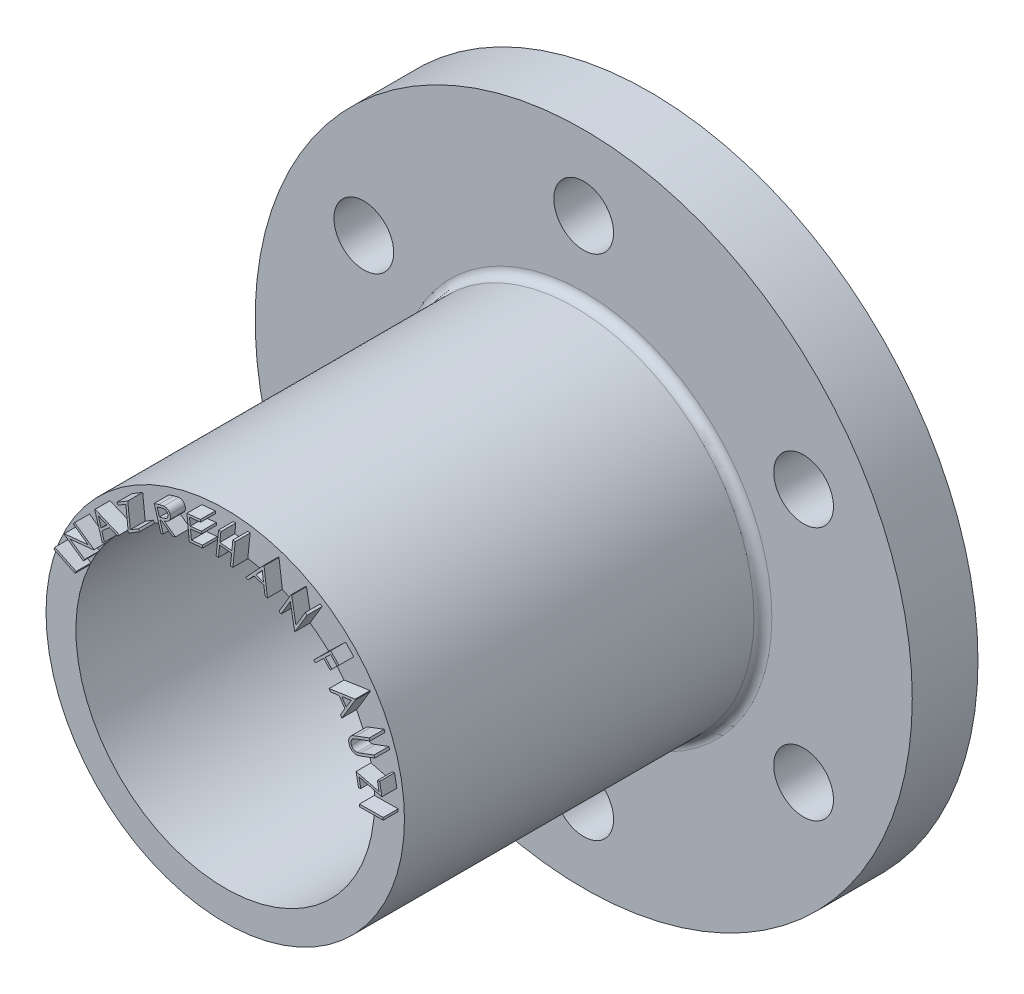
from build123d import *

# Parameters (mm, degrees)
SKETCH1_R           = 110
BOSS_EXTRUDE1_DEPTH = 22
SKETCH2_R           = 60
BOSS_EXTRUDE2_DEPTH = 120
SKETCH3_R           = 50
CUT_EXTRUDE1_DEPTH  = 211.627633515
SKETCH4_R           = 10
CUT_EXTRUDE2_DEPTH  = 197.468827044
FILLET1_R           = 3
BOSS_EXTRUDE3_DEPTH = 5


with BuildPart() as part:
    # Sketch1 → Boss-Extrude1 (new body)
    with BuildSketch(Plane.XY):
        Circle(SKETCH1_R)
    extrude(amount=BOSS_EXTRUDE1_DEPTH)

    # Sketch2 → Boss-Extrude2 (add)
    with BuildSketch(Plane.XY.offset(22)):
        Circle(SKETCH2_R)
    extrude(amount=BOSS_EXTRUDE2_DEPTH)

    # Sketch3 → Cut-Extrude1 (cut, through all)
    with BuildSketch(Plane.XY.offset(142)):
        Circle(SKETCH3_R)
    extrude(amount=-CUT_EXTRUDE1_DEPTH, mode=Mode.SUBTRACT)

    # Sketch4 → Cut-Extrude2 (cut, through all)
    with BuildSketch(Plane.XY.offset(22)):
        with Locations((0, 85)):
            Circle(SKETCH4_R)
        with Locations((73.612159322, 42.5)):
            Circle(SKETCH4_R)
        with Locations((73.612159322, -42.5)):
            Circle(SKETCH4_R)
        with Locations((0, -85)):
            Circle(SKETCH4_R)
        with Locations((-73.612159322, -42.5)):
            Circle(SKETCH4_R)
        with Locations((-73.612159322, 42.5)):
            Circle(SKETCH4_R)
    extrude(amount=-CUT_EXTRUDE2_DEPTH, mode=Mode.SUBTRACT)

    # Fillet1
    fillet1_edges = [part.edges().sort_by_distance(p)[0] for p in [
        (-60, 0, 22),
    ]]
    fillet(fillet1_edges, radius=FILLET1_R)

    # Sketch5 → Boss-Extrude3 (add)
    # profile 1 of 14: a face of its own
    with BuildSketch(Plane.XY.offset(142)):
        Polygon((57.889690715, 2.009597673), (57.900908664, 1.214725878), (49.944177894, 1.118572032), (49.932959946, 1.913443826), align=None)
    # profile 2 of 14: a face of its own
    with BuildSketch(Plane.XY.offset(142)):
        Polygon((55.930337648, 11.745643065), (56.68514534, 11.886668707), (57.449568417, 7.766476399), (49.794119699, 9.724809732), (50.369440212, 6.623848194), (49.609824828, 6.482822553), (48.81014534, 10.787309732), (56.475209443, 8.80974563), align=None)
    # profile 3 of 14: a face of its own
    with BuildSketch(Plane.XY.offset(142)):
        with BuildLine():
            Line((53.221706155, 22.727270686), (53.500552309, 21.983680942))
            Line((53.500552309, 21.983680942), (49.008565129, 20.304193763))
            add(Edge.make_bspline(
                [(49.008565129, 20.304193763), (48.944985787, 20.280185336), (48.824142847, 20.234553395), (48.652984523, 20.169396557), (48.501622149, 20.109215852), (48.368531012, 20.05729421), (48.25504079, 20.008983815), (48.160428472, 19.967445769), (48.08480114, 19.932724798), (48.041614765, 19.910104072), (48.022988206, 19.900347609)],
                knots=[0, 0, 0, 0, 1.530622665, 2.909198734, 4.12455856, 5.199154976, 6.12647182, 6.902162162, 7.526495533, 8, 8, 8, 8], degree=3))
            add(Edge.make_bspline(
                [(48.022988206, 19.900347609), (47.956394121, 19.863325512), (47.827654126, 19.791754223), (47.654297555, 19.663736071), (47.505952995, 19.523701881), (47.379088885, 19.371198347), (47.278436184, 19.199557618), (47.201075725, 19.006702797), (47.145539368, 18.791881044), (47.115199109, 18.559448568), (47.107082419, 18.321076482), (47.122795769, 18.085798669), (47.162969292, 17.858184847), (47.211856733, 17.713948028), (47.236129232, 17.642334788)],
                knots=[0, 0, 0, 0, 1.041571954, 2.013571717, 2.938929409, 3.826941683, 4.718075908, 5.649043884, 6.661177538, 7.745360051, 8.849482269, 9.918959202, 10.96676817, 12, 12, 12, 12], degree=3))
            add(Edge.make_bspline(
                [(47.236129232, 17.642334788), (47.260880986, 17.581821124), (47.309942487, 17.461874427), (47.408662997, 17.294123605), (47.522275335, 17.135810211), (47.654930657, 16.990990527), (47.80173179, 16.861665591), (47.959597827, 16.750186873), (48.127356422, 16.658324187), (48.304518526, 16.585523812), (48.491806843, 16.533988178), (48.688092788, 16.504591701), (48.893211015, 16.492057162), (49.032091207, 16.501359499), (49.103116411, 16.50611684)],
                knots=[0, 0, 0, 0, 0.99761356, 1.977412061, 2.964962012, 3.970057155, 4.970337245, 5.948401076, 6.916198033, 7.88605706, 8.868028066, 9.875604724, 10.9135556, 12, 12, 12, 12], degree=3))
            add(Edge.make_bspline(
                [(49.103116411, 16.50611684), (49.132009992, 16.510103817), (49.195988717, 16.518932135), (49.300281721, 16.540428027), (49.422860665, 16.570938264), (49.5620628, 16.613777984), (49.720940503, 16.66107171), (49.895936782, 16.7207124), (50.088829398, 16.790459496), (50.223318209, 16.839422977), (50.29382154, 16.865091199)],
                knots=[0, 0, 0, 0, 0.56172803, 1.243827937, 2.049941123, 2.994162894, 4.048781236, 5.243004811, 6.554695039, 8, 8, 8, 8], degree=3))
            Line((50.29382154, 16.865091199), (54.785808719, 18.544578378))
            Line((54.785808719, 18.544578378), (55.064654873, 17.800988635))
            Line((55.064654873, 17.800988635), (50.572667693, 16.121501455))
            add(Edge.make_bspline(
                [(50.572667693, 16.121501455), (50.491682604, 16.091510514), (50.333222671, 16.032828569), (50.097981784, 15.957281844), (49.873082007, 15.888348468), (49.657251846, 15.833279452), (49.451812016, 15.785791054), (49.255593787, 15.750013194), (49.068807098, 15.726619691), (48.890310159, 15.710708197), (48.71663382, 15.708622349), (48.544770688, 15.722369482), (48.372853561, 15.746744018), (48.202418324, 15.789935025), (48.032244946, 15.844566345), (47.86120502, 15.911488372), (47.692384826, 15.995844887), (47.523975128, 16.090495192), (47.363435572, 16.201399751), (47.209678716, 16.322245268), (47.070355025, 16.459885044), (46.941573084, 16.609315335), (46.824380066, 16.77190514), (46.718115035, 16.947573776), (46.623654678, 17.136418227), (46.570661006, 17.269064355), (46.54382154, 17.336245045)],
                knots=[0, 0, 0, 0, 1.297889816, 2.539523431, 3.713116984, 4.832906077, 5.886700863, 6.882072144, 7.829186522, 8.715358273, 9.57452841, 10.436058961, 11.304743594, 12.1810758, 13.074889758, 13.990368168, 14.938367032, 15.909378519, 16.891513671, 17.868350352, 18.844956013, 19.829942452, 20.830546276, 21.853672757, 22.912959273, 24, 24, 24, 24], degree=3))
            add(Edge.make_bspline(
                [(46.54382154, 17.336245045), (46.517091922, 17.410684144), (46.464732859, 17.556498481), (46.405856218, 17.777959909), (46.361475636, 17.995652925), (46.336926851, 18.211205156), (46.324164805, 18.423200881), (46.331430414, 18.632196333), (46.353032564, 18.838186363), (46.393929121, 19.039371155), (46.447546841, 19.234702436), (46.517025877, 19.420906827), (46.59838399, 19.597533015), (46.693543993, 19.763963672), (46.802901778, 19.920159558), (46.927063942, 20.065758529), (47.062698845, 20.203174276), (47.163199401, 20.284278403), (47.213693334, 20.325027096)],
                knots=[0, 0, 0, 0, 1.153688589, 2.259892144, 3.340728777, 4.392704464, 5.423115781, 6.436970484, 7.440705661, 8.442046695, 9.429301063, 10.393670745, 11.338819835, 12.264119443, 13.18754554, 14.116777034, 15.053822806, 16, 16, 16, 16], degree=3))
            add(Edge.make_bspline(
                [(47.213693334, 20.325027096), (47.24908495, 20.351263201), (47.325717569, 20.408071612), (47.458498455, 20.486273909), (47.612240489, 20.572057301), (47.791051676, 20.659246268), (47.992326188, 20.752042072), (48.217289005, 20.848270892), (48.46569859, 20.94692846), (48.639361975, 21.013267386), (48.729718976, 21.047783506)],
                knots=[0, 0, 0, 0, 0.627342832, 1.358370441, 2.193044037, 3.135957267, 4.191745134, 5.351104634, 6.621780628, 8, 8, 8, 8], degree=3))
            Line((48.729718976, 21.047783506), (53.221706155, 22.727270686))
        make_face()
    # profile 4 of 14: a face of its own
    with BuildSketch(Plane.XY.offset(142)):
        Polygon((48.60264696, 31.451323587), (44.049762345, 23.904849228), (43.572198242, 24.61638769), (45.052967473, 27.122797946), (43.133095678, 29.980169741), (40.25489055, 29.552285126), (39.759698242, 30.291067177), (48.493672601, 31.613182562), align=None)
        Polygon((47.142711062, 30.587541536), (43.974441832, 30.113182562), (45.496877729, 27.847156921), align=None, mode=Mode.SUBTRACT)
    # profile 5 of 14: a face of its own
    with BuildSketch(Plane.XY.offset(142)):
        Polygon((40.287668103, 41.540201608), (43.05209118, 38.698855454), (42.492796308, 38.153983659), (40.276450154, 40.432829813), (38.502411692, 38.708470839), (40.718757846, 36.429624685), (40.159462975, 35.88475289), (37.943116821, 38.163599044), (35.162668103, 35.460073403), (34.61459118, 36.022573403), align=None)
    # profile 6 of 14: a face of its own
    with BuildSketch(Plane.XY.offset(142)):
        Polygon((22.991479633, 44.324430711), (27.076415531, 51.175392249), (27.225453992, 51.087251224), (28.653338608, 43.127315326), (31.779941172, 48.37090507), (32.456223223, 47.967058916), (28.371287325, 41.116097377), (28.217441172, 41.207443531), (26.787953992, 49.082443531), (23.699812966, 43.902956352), align=None)
    # profile 7 of 14: a face of its own
    with BuildSketch(Plane.XY.offset(142)):
        Polygon((17.995237439, 54.955604754), (19.125045131, 46.244066293), (18.309340003, 46.503681677), (17.910301542, 49.378681677), (14.639468208, 50.415540652), (12.661904106, 48.295348344), (11.81575026, 48.564579113), (17.809340003, 55.014899626), align=None)
        Polygon((17.391070772, 53.377079113), (15.211583593, 51.040540652), (17.806134875, 50.216822703), align=None, mode=Mode.SUBTRACT)
    # profile 8 of 14: a face of its own
    with BuildSketch(Plane.XY.offset(142)):
        Polygon((2.748785358, 57.776850213), (3.542054589, 57.696722008), (3.207118692, 54.390632264), (7.215131512, 53.983580982), (7.55006741, 57.289670725), (8.34333664, 57.20954252), (7.543657153, 49.3265297), (6.750387922, 49.406657905), (7.136605871, 53.211145084), (3.128593051, 53.618196366), (2.742375102, 49.813709187), (1.949105871, 49.893837392), align=None)
    # profile 9 of 14: a face of its own
    with BuildSketch(Plane.XY.offset(142)):
        Polygon((-7.825227036, 57.33819266), (-3.307598831, 57.796525993), (-3.22907319, 57.019282403), (-6.95984242, 56.641077275), (-6.70984242, 54.176333685), (-3.011124472, 54.551333685), (-2.932598831, 53.778897788), (-6.631316779, 53.403897788), (-6.317214215, 50.312551634), (-2.618496267, 50.687551634), (-2.539970626, 49.910308044), (-7.025547549, 49.455179839), align=None)
    # profile 10 of 14: a face of its own
    with BuildSketch(Plane.XY.offset(142)):
        with BuildLine():
            Line((-18.789459191, 54.715105483), (-17.278241242, 55.165425996))
            add(Edge.make_bspline(
                [(-17.278241242, 55.165425996), (-17.176868124, 55.195766639), (-16.983119681, 55.253754914), (-16.70328044, 55.330235051), (-16.448484427, 55.397621441), (-16.21867164, 55.456148619), (-16.012843559, 55.501389992), (-15.831539876, 55.534690822), (-15.675165896, 55.560432476), (-15.578516638, 55.568717187), (-15.534651498, 55.572477278)],
                knots=[0, 0, 0, 0, 1.416180788, 2.706662563, 3.882425669, 4.943640466, 5.880417398, 6.702144752, 7.410956657, 8, 8, 8, 8], degree=3))
            add(Edge.make_bspline(
                [(-15.534651498, 55.572477278), (-15.475365788, 55.574967824), (-15.358355977, 55.579883313), (-15.184100881, 55.571757352), (-15.014761792, 55.549371436), (-14.849850835, 55.513509257), (-14.689513644, 55.466428041), (-14.534700338, 55.402459822), (-14.383981343, 55.327329522), (-14.238171307, 55.239667307), (-14.100714927, 55.138431259), (-13.971854984, 55.027020815), (-13.856374242, 54.901738392), (-13.749104559, 54.767584613), (-13.657574112, 54.61876411), (-13.572820331, 54.46112021), (-13.501037017, 54.291379313), (-13.462719649, 54.172681924), (-13.443305345, 54.112541381)],
                knots=[0, 0, 0, 0, 1.028064753, 2.029049847, 3.018969712, 3.98504948, 4.951661476, 5.911018827, 6.884038882, 7.868488334, 8.855503103, 9.839691302, 10.815702023, 11.804755589, 12.811674712, 13.838821885, 14.904993384, 16, 16, 16, 16], degree=3))
            add(Edge.make_bspline(
                [(-13.443305345, 54.112541381), (-13.417231484, 54.011042971), (-13.366417962, 53.813239818), (-13.334607976, 53.512129366), (-13.350059434, 53.219081366), (-13.40409695, 52.935572024), (-13.498795351, 52.665204402), (-13.636548514, 52.41362641), (-13.814156527, 52.181847244), (-13.992716145, 52.006757134), (-14.158503652, 51.878566311), (-14.297660955, 51.781662714), (-14.453485038, 51.690989474), (-14.624766279, 51.604594629), (-14.810192175, 51.519937104), (-15.010880728, 51.437764716), (-15.227321139, 51.361472299), (-15.377448424, 51.314527372), (-15.454523293, 51.290425996)],
                knots=[0, 0, 0, 0, 1.275548258, 2.485826816, 3.671696352, 4.838248209, 5.990884873, 7.147025195, 8.317165726, 9.536699618, 10.181104718, 10.868873273, 11.601053028, 12.375236829, 13.205206465, 14.083785536, 15.016221611, 16, 16, 16, 16], degree=3))
            Line((-15.454523293, 51.290425996), (-11.674074575, 48.574079842))
            Line((-11.674074575, 48.574079842), (-12.613177139, 48.293631124))
            Line((-12.613177139, 48.293631124), (-16.388818165, 51.011579842))
            Line((-16.388818165, 51.011579842), (-16.821510473, 50.88177215))
            Line((-16.821510473, 50.88177215), (-15.770228422, 47.352925996))
            Line((-15.770228422, 47.352925996), (-16.528241242, 47.126964458))
            Line((-16.528241242, 47.126964458), (-18.789459191, 54.715105483))
        make_face()
        with BuildLine():
            Line((-17.810292524, 54.197477278), (-17.041061755, 51.618951637))
            Line((-17.041061755, 51.618951637), (-15.733369447, 51.997156765))
            add(Edge.make_bspline(
                [(-15.733369447, 51.997156765), (-15.672383587, 52.016113838), (-15.554290267, 52.052822406), (-15.384855393, 52.110392419), (-15.228887981, 52.167516282), (-15.087235023, 52.227005112), (-14.959519723, 52.287606541), (-14.844667083, 52.348443088), (-14.743959282, 52.410489471), (-14.628840432, 52.493287477), (-14.50507473, 52.605636898), (-14.383846697, 52.758234847), (-14.287050185, 52.925142214), (-14.221199066, 53.107248178), (-14.178937912, 53.296383501), (-14.166312323, 53.490253801), (-14.181276316, 53.685629506), (-14.214809951, 53.812705846), (-14.231766883, 53.876964458)],
                knots=[0, 0, 0, 0, 1.117936806, 2.164778337, 3.13230755, 4.024999125, 4.853207358, 5.606260702, 6.299138943, 6.922034833, 8.087009843, 9.211536912, 10.321545266, 11.448868318, 12.587920969, 13.703234288, 14.838595947, 16, 16, 16, 16], degree=3))
            add(Edge.make_bspline(
                [(-14.231766883, 53.876964458), (-14.25299434, 53.938585042), (-14.294884053, 54.060185505), (-14.387582082, 54.228688214), (-14.504692869, 54.379209972), (-14.64227001, 54.51126371), (-14.795021553, 54.624032647), (-14.961370689, 54.709356871), (-15.136906785, 54.768151397), (-15.291241062, 54.793671693), (-15.42403145, 54.799817895), (-15.537106103, 54.796586556), (-15.662715975, 54.782711218), (-15.800631829, 54.761762213), (-15.951317482, 54.732590592), (-16.114299297, 54.695652745), (-16.290245931, 54.650655339), (-16.410832003, 54.615079359), (-16.473754063, 54.59651574)],
                knots=[0, 0, 0, 0, 1.163340894, 2.295706741, 3.418694656, 4.559882183, 5.694299164, 6.800313581, 7.887288178, 8.990785687, 9.5834604, 10.261644306, 11.010302916, 11.840767966, 12.754596324, 13.752954935, 14.827487275, 16, 16, 16, 16], degree=3))
            Line((-16.473754063, 54.59651574), (-17.810292524, 54.197477278))
        make_face(mode=Mode.SUBTRACT)
    # profile 11 of 14: a face of its own
    with BuildSketch(Plane.XY.offset(142)):
        Polygon((-30.851758144, 48.155538632), (-31.249194042, 48.817397607), (-27.635411991, 50.988871966), (-26.784450452, 43.083423248), (-24.063296606, 44.718038632), (-23.66265558, 44.051371966), (-27.43989917, 41.782141196), (-28.276437632, 49.703615555), align=None)
    # profile 12 of 14: a face of its own
    with BuildSketch(Plane.XY.offset(142)):
        Polygon((-38.568656754, 43.118596604), (-30.438849061, 39.73398122), (-31.071861882, 39.157058143), (-33.767374702, 40.251609425), (-36.307438805, 37.932699168), (-35.45807983, 35.15225045), (-36.115131112, 34.551288912), (-38.712887523, 42.987186348), align=None)
        Polygon((-37.499746497, 41.802891476), (-36.562246497, 38.74199404), (-34.54782342, 40.58173763), align=None, mode=Mode.SUBTRACT)
    # profile 13 of 14: a face of its own
    with BuildSketch(Plane.XY.offset(142)):
        Polygon((-42.52224261, 26.170052483), (-49.004614404, 30.743770432), (-48.90525543, 30.884796073), (-40.900447738, 31.695693509), (-45.861986199, 35.195693509), (-45.413268251, 35.833514022), (-38.930896456, 31.259796073), (-39.031857994, 31.115565304), (-46.950127225, 30.298257611), (-42.049486199, 26.839924278), align=None)
    # profile 14 of 14: a face of its own
    with BuildSketch(Plane.XY.offset(142)):
        Polygon((-52.399882467, 24.649806327), (-52.058536313, 25.364549917), (-44.91270298, 21.941472994), (-45.254049134, 21.226729404), align=None)
    extrude(amount=BOSS_EXTRUDE3_DEPTH)


solid = part.part
